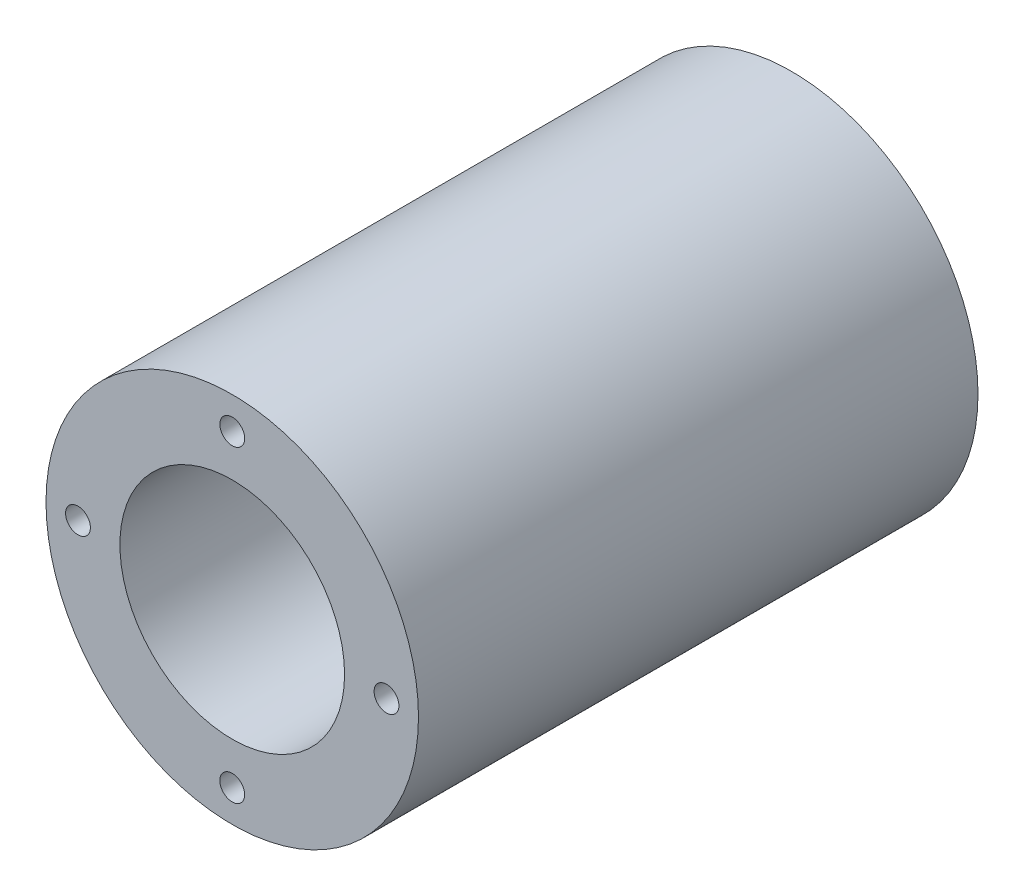
from build123d import *

# Parameters (mm, degrees)
SKETCH1_W              = 112.659
SKETCH1_H              = 14.8813
BACKFACEPATTERN_COUNT  = 6
FRONTFACEPATTERN_COUNT = 4
SKETCH7_R              = 26.9875
SKETCH7_R_2            = 25.4
CUT_EXTRUDE1_DEPTH     = 0.5


with BuildPart() as part:
    # Sketch1 → Revolve1 (revolve)
    with BuildSketch(Plane(origin=(0, 0, 0), x_dir=(0, 0, -1), z_dir=(1, 0, 0)), mode=Mode.PRIVATE) as revolve1_sk:
        with Locations((-79.9545, 30.05935)):
            Rectangle(SKETCH1_W, SKETCH1_H)
    revolve(revolve1_sk.sketch.rotate(Axis((0, 0, 136.284), (0, 0, -1)), 90), axis=Axis((0, 0, 136.284), (0, 0, -1)))

    # Sketch9 → M6x1.0 Tapped Hole3 (revolve, cut)
    with BuildSketch(Plane(origin=(0, 31.05935, 23.625), x_dir=(0, 1, 0), z_dir=(1, 0, 0))):
        Polygon((0, 0), (0, 16.502151548), (2.5, 15), (2.5, 0), align=None)
    m6x1_0_tapped_hole3 = revolve(axis=Axis((0, 31.05935, 17.275), (0, 0, 1)), mode=Mode.SUBTRACT)

    # BackFacePattern: M6x1.0 Tapped Hole3 ×6 about axis
    backfacepattern_axis = Axis((0, 0, 0), (0, 0, 1))
    for i in range(1, BACKFACEPATTERN_COUNT):
        add(m6x1_0_tapped_hole3.rotate(backfacepattern_axis, i * 360 / BACKFACEPATTERN_COUNT), mode=Mode.SUBTRACT)

    # Sketch6 → M6x1.0 Tapped Hole2 (revolve, cut)
    with BuildSketch(Plane(origin=(0, 31.05935, 136.284), x_dir=(0, -1, 0), z_dir=(1, 0, 0))):
        Polygon((0, 0), (0, 16.502151548), (2.5, 15), (2.5, 0), align=None)
    m6x1_0_tapped_hole2 = revolve(axis=Axis((0, 31.05935, 142.634), (0, 0, -1)), mode=Mode.SUBTRACT)

    # FrontFacePattern: M6x1.0 Tapped Hole2 ×4 about axis
    frontfacepattern_axis = Axis((0, 0, 0), (0, 0, 1))
    for i in range(1, FRONTFACEPATTERN_COUNT):
        add(m6x1_0_tapped_hole2.rotate(frontfacepattern_axis, i * 360 / FRONTFACEPATTERN_COUNT), mode=Mode.SUBTRACT)

    # Sketch7 → Cut-Extrude1 (cut)
    with BuildSketch(Plane(origin=(0, 0, 23.625), x_dir=(-1, 0, 0), z_dir=(0, 0, -1))):
        with Locations(Location((0, 0, 0), (0, 0, 90))):
            Circle(SKETCH7_R)
        with Locations(Location((0, 0, 0), (0, 0, 90))):
            Circle(SKETCH7_R_2, mode=Mode.SUBTRACT)
    extrude(amount=-CUT_EXTRUDE1_DEPTH, mode=Mode.SUBTRACT)


solid = part.part
